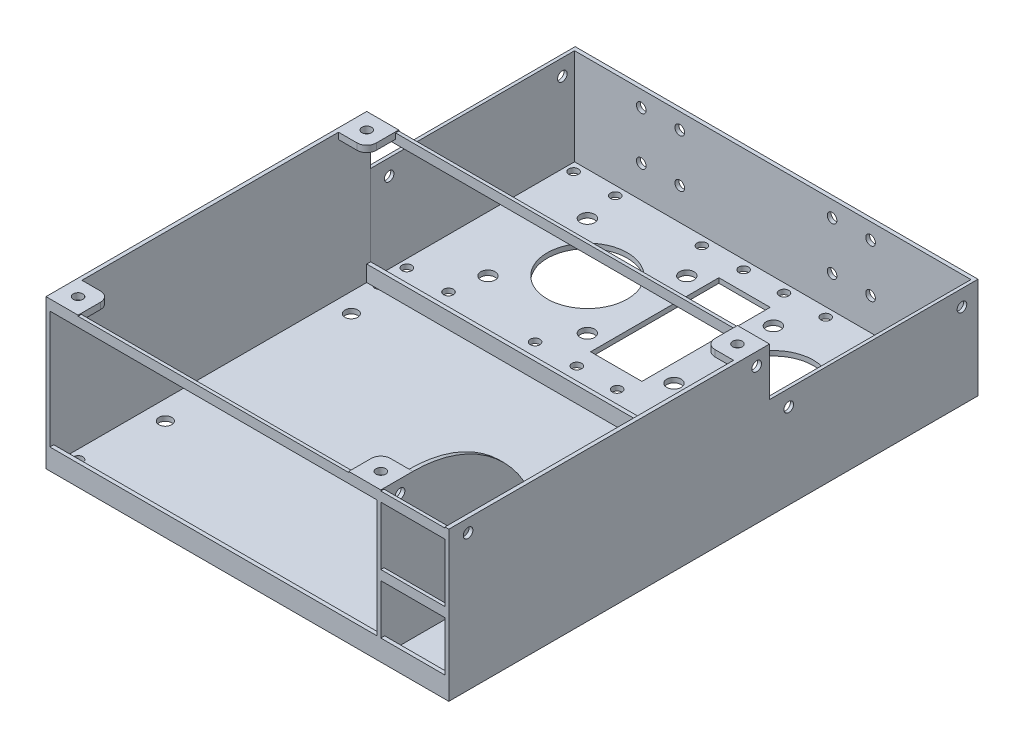
from build123d import *

# Parameters (mm, degrees)
SKETCH_1_W          = 125.6
SKETCH_1_H          = 165
SKETCH_1_R          = 2
SKETCH_1_R_2        = 12.5
SKETCH_1_R_3        = 2.25
SKETCH_1_R_4        = 1.5
SKETCH_1_W_2        = 10
SKETCH_1_H_2        = 23
SKETCH_1_W_3        = 16
SKETCH_1_H_3        = 40
EXTRUDE_1_DEPTH     = 1.5
SKETCH_2_W          = 1.2
SKETCH_2_H          = 100
SKETCH_2_H_2        = 50
EXTRUDE_2_DEPTH     = 45
SKETCH_3_W          = 125.6
SKETCH_3_H          = 1.2
SKETCH_3_W_2        = 22.4
EXTRUDE_3_DEPTH     = 5
SKETCH_4_W          = 22.4
SKETCH_4_H          = 3
SKETCH_4_W_2        = 125.6
EXTRUDE_4_DEPTH     = 1
SKETCH_5_W          = 125.6
SKETCH_5_H          = 3
EXTRUDE_5_DEPTH     = 1
FILLET_1_R          = 40
SKETCH_6_R          = 1.5
EXTRUDE_6_DEPTH     = 2
EXTRUDE_7_DEPTH     = 30
CUT_EXTRUDE_1_REACH = 214.515
SKETCH_9_R          = 1.5
SKETCH_10_R         = 1.5
CUT_EXTRUDE_2_DEPTH = 213.514964179
SKETCH_11_R         = 1.5
CUT_EXTRUDE_3_DEPTH = 213.514964179


with BuildPart() as part:
    # 草图1 → 凸台-拉伸1 (new body)
    with BuildSketch(Plane(origin=(0, 0, 0), x_dir=(1, 0, 0), z_dir=(0, 1, 0))):
        with Locations((62.8, 82.5)):
            Rectangle(SKETCH_1_W, SKETCH_1_H)
        with Locations(Location((93.2, 30, 0), (0, 0, 270))):
            Circle(SKETCH_1_R, mode=Mode.SUBTRACT)
        with Locations(Location((93.2, 88, 0), (0, 0, 270))):
            Circle(SKETCH_1_R, mode=Mode.SUBTRACT)
        with Locations(Location((7.2, 30, 0), (0, 0, 90))):
            Circle(SKETCH_1_R, mode=Mode.SUBTRACT)
        with Locations(Location((7.2, 88, 0), (0, 0, 90))):
            Circle(SKETCH_1_R, mode=Mode.SUBTRACT)
        with Locations(Location((33.8, 135, 0), (0, 0, 270))):
            Circle(SKETCH_1_R_2, mode=Mode.SUBTRACT)
        with Locations(Location((91.8, 135, 0), (0, 0, 90))):
            Circle(SKETCH_1_R_2, mode=Mode.SUBTRACT)
        with Locations(Location((49.3, 150.5, 0), (0, 0, 270))):
            Circle(SKETCH_1_R_3, mode=Mode.SUBTRACT)
        with Locations(Location((18.3, 150.5, 0), (0, 0, 90))):
            Circle(SKETCH_1_R_3, mode=Mode.SUBTRACT)
        with Locations(Location((49.3, 119.5, 0), (0, 0, 90))):
            Circle(SKETCH_1_R_3, mode=Mode.SUBTRACT)
        with Locations(Location((18.3, 119.5, 0), (0, 0, 270))):
            Circle(SKETCH_1_R_3, mode=Mode.SUBTRACT)
        with Locations(Location((107.3, 119.5, 0), (0, 0, 90))):
            Circle(SKETCH_1_R_3, mode=Mode.SUBTRACT)
        with Locations(Location((76.3, 119.5, 0), (0, 0, 270))):
            Circle(SKETCH_1_R_3, mode=Mode.SUBTRACT)
        with Locations(Location((107.3, 150.5, 0), (0, 0, 270))):
            Circle(SKETCH_1_R_3, mode=Mode.SUBTRACT)
        with Locations(Location((76.3, 150.5, 0), (0, 0, 90))):
            Circle(SKETCH_1_R_3, mode=Mode.SUBTRACT)
        with Locations(Location((122.1, 161, 0), (0, 0, 270))):
            Circle(SKETCH_1_R_4, mode=Mode.SUBTRACT)
        with Locations(Location((122.1, 109, 0), (0, 0, 90))):
            Circle(SKETCH_1_R_4, mode=Mode.SUBTRACT)
        with Locations(Location((109.1, 109, 0), (0, 0, 270))):
            Circle(SKETCH_1_R_4, mode=Mode.SUBTRACT)
        with Locations(Location((109.1, 161, 0), (0, 0, 90))):
            Circle(SKETCH_1_R_4, mode=Mode.SUBTRACT)
        with Locations(Location((16.5, 109, 0), (0, 0, 90))):
            Circle(SKETCH_1_R_4, mode=Mode.SUBTRACT)
        with Locations(Location((3.5, 109, 0), (0, 0, 270))):
            Circle(SKETCH_1_R_4, mode=Mode.SUBTRACT)
        with Locations(Location((16.5, 161, 0), (0, 0, 270))):
            Circle(SKETCH_1_R_4, mode=Mode.SUBTRACT)
        with Locations(Location((3.5, 161, 0), (0, 0, 90))):
            Circle(SKETCH_1_R_4, mode=Mode.SUBTRACT)
        with Locations(Location((69.1, 109, 0), (0, 0, 270))):
            Circle(SKETCH_1_R_4, mode=Mode.SUBTRACT)
        with Locations(Location((82.1, 109, 0), (0, 0, 90))):
            Circle(SKETCH_1_R_4, mode=Mode.SUBTRACT)
        with Locations(Location((82.1, 161, 0), (0, 0, 270))):
            Circle(SKETCH_1_R_4, mode=Mode.SUBTRACT)
        with Locations(Location((69.1, 161, 0), (0, 0, 90))):
            Circle(SKETCH_1_R_4, mode=Mode.SUBTRACT)
        with Locations(Location((56.5, 161, 0), (0, 0, 270))):
            Circle(SKETCH_1_R_4, mode=Mode.SUBTRACT)
        with Locations(Location((43.5, 161, 0), (0, 0, 90))):
            Circle(SKETCH_1_R_4, mode=Mode.SUBTRACT)
        with Locations(Location((56.5, 109, 0), (0, 0, 90))):
            Circle(SKETCH_1_R_4, mode=Mode.SUBTRACT)
        with Locations(Location((43.5, 109, 0), (0, 0, 270))):
            Circle(SKETCH_1_R_4, mode=Mode.SUBTRACT)
        with Locations(Location((4, 100, 0), (0, 0, 270))):
            Circle(SKETCH_1_R_4, mode=Mode.SUBTRACT)
        with Locations(Location((4, 6, 0), (0, 0, 270))):
            Circle(SKETCH_1_R_4, mode=Mode.SUBTRACT)
        with Locations(Location((121.6, 6, 0), (0, 0, 90))):
            Circle(SKETCH_1_R_4, mode=Mode.SUBTRACT)
        with Locations(Location((121.6, 100, 0), (0, 0, 90))):
            Circle(SKETCH_1_R_4, mode=Mode.SUBTRACT)
        with Locations((114.4, 66.5)):
            Rectangle(SKETCH_1_W_2, SKETCH_1_H_2, mode=Mode.SUBTRACT)
        with Locations((62.8, 135)):
            Rectangle(SKETCH_1_W_3, SKETCH_1_H_3, mode=Mode.SUBTRACT)
    extrude(amount=EXTRUDE_1_DEPTH)

    # 草图2 → 凸台-拉伸2 (add)
    with BuildSketch(Plane(origin=(0, 1.5, 0), x_dir=(1, 0, 0), z_dir=(0, 1, 0))):
        with Locations((0.6, 50)):
            Rectangle(SKETCH_2_W, SKETCH_2_H)
        with Locations((103.8, 25)):
            Rectangle(SKETCH_2_W, SKETCH_2_H_2)
        with Locations((125, 50)):
            Rectangle(SKETCH_2_W, SKETCH_2_H)
    extrude(amount=EXTRUDE_2_DEPTH)

    # 草图3 → 凸台-拉伸3 (add)
    with BuildSketch(Plane(origin=(0, 1.5, 0), x_dir=(1, 0, 0), z_dir=(0, 1, 0))):
        with Locations((62.8, 0.6)):
            Rectangle(SKETCH_3_W, SKETCH_3_H)
        with Locations((62.8, 99.4)):
            Rectangle(SKETCH_3_W, SKETCH_3_H)
        with Locations((114.4, 47.8)):
            Rectangle(SKETCH_3_W_2, SKETCH_3_H)
    extrude(amount=EXTRUDE_3_DEPTH)

    # 草图4 → 凸台-拉伸4 (add)
    with BuildSketch(Plane.XY):
        with Locations((114.4, 23.5)):
            Rectangle(SKETCH_4_W, SKETCH_4_H)
        with Locations((62.8, 44.7)):
            Rectangle(SKETCH_4_W_2, SKETCH_4_H)
    extrude(amount=-EXTRUDE_4_DEPTH)

    # 草图5 → 凸台-拉伸5 (add)
    with BuildSketch(Plane(origin=(0, 0, -100), x_dir=(-1, 0, 0), z_dir=(0, 0, -1))):
        with Locations((-62.8, 44.7)):
            Rectangle(SKETCH_5_W, SKETCH_5_H)
    extrude(amount=-EXTRUDE_5_DEPTH)

    # 圆角1
    fillet_1_edges = [part.edges().sort_by_distance(p)[0] for p in [
        (103.8, 46.5, -50),
    ]]
    fillet(fillet_1_edges, radius=FILLET_1_R)

    # 草图6 → 凸台-拉伸6 (add)
    # profile 1 of 4: a face of its own
    with BuildSketch(Plane(origin=(0, 46.5, 0), x_dir=(1, 0, 0), z_dir=(0, 1, 0))):
        with BuildLine():
            Line((0, 0), (10, 0))
            Line((10, 0), (10, 7))
            ThreePointArc((10, 7), (9.121320344, 9.121320344), (7, 10))
            Line((7, 10), (0, 10))
            Line((0, 10), (0, 0))
        make_face()
        with Locations(Location((5, 5, 0), (0, 0, 270))):
            Circle(SKETCH_6_R, mode=Mode.SUBTRACT)
    # profile 2 of 4: a face of its own
    with BuildSketch(Plane(origin=(0, 46.5, 0), x_dir=(1, 0, 0), z_dir=(0, 1, 0))):
        with BuildLine():
            Line((10, 100), (10, 93))
            ThreePointArc((10, 93), (9.121320344, 90.878679656), (7, 90))
            Line((7, 90), (0, 90))
            Line((0, 90), (0, 100))
            Line((0, 100), (10, 100))
        make_face()
        with Locations(Location((5, 95, 0), (0, 0, 90))):
            Circle(SKETCH_6_R, mode=Mode.SUBTRACT)
    # profile 3 of 4: a face of its own
    with BuildSketch(Plane(origin=(0, 46.5, 0), x_dir=(1, 0, 0), z_dir=(0, 1, 0))):
        with BuildLine():
            Line((94.4, 0), (94.4, 7))
            ThreePointArc((94.4, 7), (95.278679656, 9.121320344), (97.4, 10))
            Line((97.4, 10), (104.4, 10))
            Line((104.4, 10), (104.4, 0))
            Line((104.4, 0), (94.4, 0))
        make_face()
        with Locations(Location((99.4, 5, 0), (0, 0, 90))):
            Circle(SKETCH_6_R, mode=Mode.SUBTRACT)
    # profile 4 of 4: a face of its own
    with BuildSketch(Plane(origin=(0, 46.5, 0), x_dir=(1, 0, 0), z_dir=(0, 1, 0))):
        with BuildLine():
            Line((125.6, 100), (115.6, 100))
            Line((115.6, 100), (115.6, 93))
            ThreePointArc((115.6, 93), (116.478679656, 90.878679656), (118.6, 90))
            Line((118.6, 90), (125.6, 90))
            Line((125.6, 90), (125.6, 100))
        make_face()
        with Locations(Location((120.6, 95, 0), (0, 0, 270))):
            Circle(SKETCH_6_R, mode=Mode.SUBTRACT)
    extrude(amount=-EXTRUDE_6_DEPTH)

    # 草图8 → 凸台-拉伸7 (add)
    with BuildSketch(Plane(origin=(0, 1.5, 0), x_dir=(1, 0, 0), z_dir=(0, 1, 0))):
        Polygon((125.6, 100), (124.6, 100), (124.6, 163.8), (1, 163.8), (1, 100), (0, 100), (0, 165), (125.6, 165), align=None)
    extrude(amount=EXTRUDE_7_DEPTH)

    # 草图9 → 切除-拉伸1 (cut, up to next)
    with BuildSketch(Plane(origin=(0, 0, -165), x_dir=(-1, 0, 0), z_dir=(0, 0, -1)), mode=Mode.PRIVATE) as cut_extrude_1_sk1:
        with Locations((-33.8, 26.5)):
            Circle(SKETCH_9_R)
    cut_extrude_1_tool1 = extrude(cut_extrude_1_sk1.sketch, amount=-CUT_EXTRUDE_1_REACH, mode=Mode.PRIVATE) & part.part
    # 草图9 → 切除-拉伸1 (cut, up to next)
    with BuildSketch(Plane(origin=(0, 0, -165), x_dir=(-1, 0, 0), z_dir=(0, 0, -1)), mode=Mode.PRIVATE) as cut_extrude_1_sk2:
        with Locations((-21.8, 26.5)):
            Circle(SKETCH_9_R)
    cut_extrude_1_tool2 = extrude(cut_extrude_1_sk2.sketch, amount=-CUT_EXTRUDE_1_REACH, mode=Mode.PRIVATE) & part.part
    # 草图9 → 切除-拉伸1 (cut, up to next)
    with BuildSketch(Plane(origin=(0, 0, -165), x_dir=(-1, 0, 0), z_dir=(0, 0, -1)), mode=Mode.PRIVATE) as cut_extrude_1_sk3:
        with Locations((-21.8, 11.5)):
            Circle(SKETCH_9_R)
    cut_extrude_1_tool3 = extrude(cut_extrude_1_sk3.sketch, amount=-CUT_EXTRUDE_1_REACH, mode=Mode.PRIVATE) & part.part
    # 草图9 → 切除-拉伸1 (cut, up to next)
    with BuildSketch(Plane(origin=(0, 0, -165), x_dir=(-1, 0, 0), z_dir=(0, 0, -1)), mode=Mode.PRIVATE) as cut_extrude_1_sk4:
        with Locations((-33.8, 11.5)):
            Circle(SKETCH_9_R)
    cut_extrude_1_tool4 = extrude(cut_extrude_1_sk4.sketch, amount=-CUT_EXTRUDE_1_REACH, mode=Mode.PRIVATE) & part.part
    # 草图9 → 切除-拉伸1 (cut, up to next)
    with BuildSketch(Plane(origin=(0, 0, -165), x_dir=(-1, 0, 0), z_dir=(0, 0, -1)), mode=Mode.PRIVATE) as cut_extrude_1_sk5:
        with Locations((-81.3, 11.5)):
            Circle(SKETCH_9_R)
    cut_extrude_1_tool5 = extrude(cut_extrude_1_sk5.sketch, amount=-CUT_EXTRUDE_1_REACH, mode=Mode.PRIVATE) & part.part
    # 草图9 → 切除-拉伸1 (cut, up to next)
    with BuildSketch(Plane(origin=(0, 0, -165), x_dir=(-1, 0, 0), z_dir=(0, 0, -1)), mode=Mode.PRIVATE) as cut_extrude_1_sk6:
        with Locations((-93.3, 11.5)):
            Circle(SKETCH_9_R)
    cut_extrude_1_tool6 = extrude(cut_extrude_1_sk6.sketch, amount=-CUT_EXTRUDE_1_REACH, mode=Mode.PRIVATE) & part.part
    # 草图9 → 切除-拉伸1 (cut, up to next)
    with BuildSketch(Plane(origin=(0, 0, -165), x_dir=(-1, 0, 0), z_dir=(0, 0, -1)), mode=Mode.PRIVATE) as cut_extrude_1_sk7:
        with Locations((-93.3, 26.5)):
            Circle(SKETCH_9_R)
    cut_extrude_1_tool7 = extrude(cut_extrude_1_sk7.sketch, amount=-CUT_EXTRUDE_1_REACH, mode=Mode.PRIVATE) & part.part
    # 草图9 → 切除-拉伸1 (cut, up to next)
    with BuildSketch(Plane(origin=(0, 0, -165), x_dir=(-1, 0, 0), z_dir=(0, 0, -1)), mode=Mode.PRIVATE) as cut_extrude_1_sk8:
        with Locations((-81.3, 26.5)):
            Circle(SKETCH_9_R)
    cut_extrude_1_tool8 = extrude(cut_extrude_1_sk8.sketch, amount=-CUT_EXTRUDE_1_REACH, mode=Mode.PRIVATE) & part.part
    add(cut_extrude_1_tool1.solids().sort_by_distance((33.8, 26.5, -165))[0], mode=Mode.SUBTRACT)
    add(cut_extrude_1_tool2.solids().sort_by_distance((21.8, 26.5, -165))[0], mode=Mode.SUBTRACT)
    add(cut_extrude_1_tool3.solids().sort_by_distance((21.8, 11.5, -165))[0], mode=Mode.SUBTRACT)
    add(cut_extrude_1_tool4.solids().sort_by_distance((33.8, 11.5, -165))[0], mode=Mode.SUBTRACT)
    add(cut_extrude_1_tool5.solids().sort_by_distance((81.3, 11.5, -165))[0], mode=Mode.SUBTRACT)
    add(cut_extrude_1_tool6.solids().sort_by_distance((93.3, 11.5, -165))[0], mode=Mode.SUBTRACT)
    add(cut_extrude_1_tool7.solids().sort_by_distance((93.3, 26.5, -165))[0], mode=Mode.SUBTRACT)
    add(cut_extrude_1_tool8.solids().sort_by_distance((81.3, 26.5, -165))[0], mode=Mode.SUBTRACT)

    # 草图10 → 切除-拉伸2 (cut, through all)
    with BuildSketch(Plane(origin=(125.6, 0, 0), x_dir=(0, 0, -1), z_dir=(1, 0, 0))):
        with Locations((96, 42.5)):
            Circle(SKETCH_10_R)
        with Locations((6, 42.5)):
            Circle(SKETCH_10_R)
    extrude(amount=-CUT_EXTRUDE_2_DEPTH, mode=Mode.SUBTRACT)

    # 草图11 → 切除-拉伸3 (cut, through all)
    with BuildSketch(Plane(origin=(125.6, 0, 0), x_dir=(0, 0, -1), z_dir=(1, 0, 0))):
        with Locations((160, 26.5)):
            Circle(SKETCH_11_R)
        with Locations((106, 26.5)):
            Circle(SKETCH_11_R)
    extrude(amount=-CUT_EXTRUDE_3_DEPTH, mode=Mode.SUBTRACT)


solid = part.part
